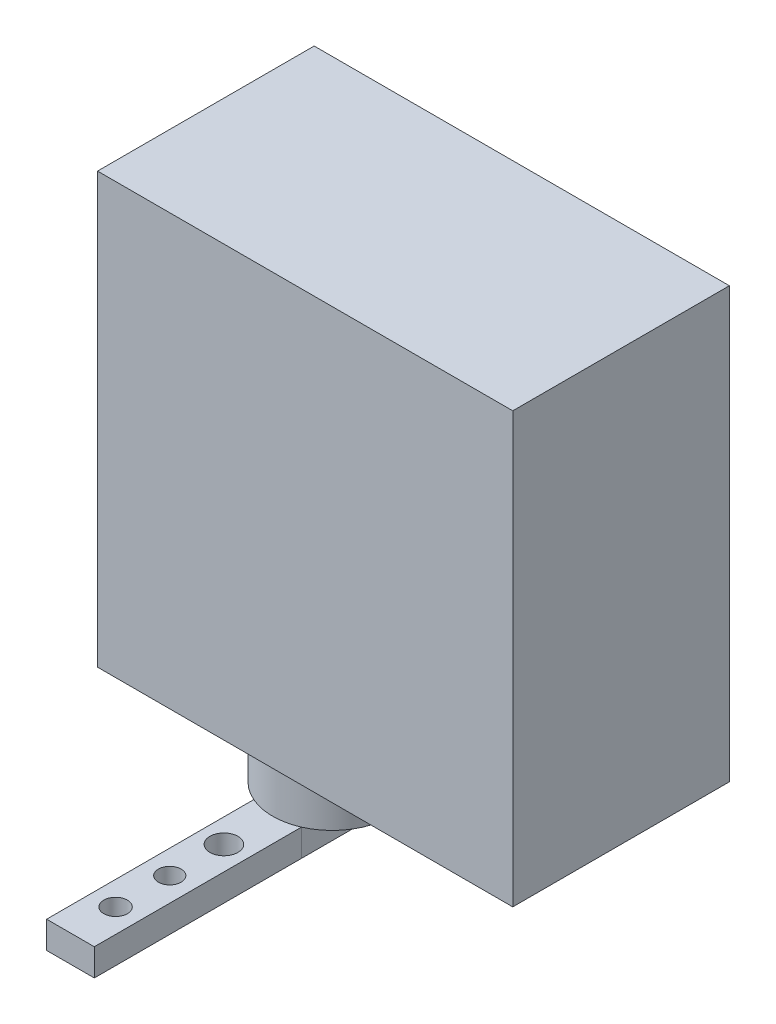
from build123d import *

# Parameters (mm, degrees)
SKETCH1_W           = 23
SKETCH1_H           = 12
BOSS_EXTRUDE1_DEPTH = 23.8
SKETCH2_R           = 3.3
BOSS_EXTRUDE2_DEPTH = 5
SKETCH3_R           = 0.7756072
SKETCH3_R_2         = 0.6312306
SKETCH3_R_3         = 0.654535051
BOSS_EXTRUDE3_DEPTH = 1.5


with BuildPart() as part:
    # Sketch1 → Boss-Extrude1 (new body)
    with BuildSketch(Plane(origin=(0, 0, 0), x_dir=(1, 0, 0), z_dir=(0, 1, 0))):
        with Locations((11.5, 6)):
            Rectangle(SKETCH1_W, SKETCH1_H)
    extrude(amount=BOSS_EXTRUDE1_DEPTH)

    # Sketch2 → Boss-Extrude2 (add)
    with BuildSketch(Plane.XZ):
        with Locations(Location((7, -6, 0), (0, 0, 270))):
            Circle(SKETCH2_R)
    extrude(amount=BOSS_EXTRUDE2_DEPTH)

    # Sketch3 → Boss-Extrude3 (add)
    # profile 1 of 6: a face of its own
    with BuildSketch(Plane.XZ.offset(5)):
        with BuildLine():
            Line((5.679025589, 8.5), (5.679025589, -2.973967359))
            ThreePointArc((5.679025589, -2.973967359), (7, -2.698205497), (8.320974411, -2.973967359))
            Line((8.320974411, -2.973967359), (8.320974411, 8.5))
            Line((8.320974411, 8.5), (5.679025589, 8.5))
        make_face()
        with Locations(Location((7, 0, 0), (0, 0, 270))):
            Circle(SKETCH3_R, mode=Mode.SUBTRACT)
        with Locations(Location((7, 3, 0), (0, 0, 270))):
            Circle(SKETCH3_R_2, mode=Mode.SUBTRACT)
        with Locations(Location((7, 6, 0), (0, 0, 270))):
            Circle(SKETCH3_R_3, mode=Mode.SUBTRACT)
    # profile 2 of 6: a face of its own
    with BuildSketch(Plane.XZ.offset(5)):
        with BuildLine():
            Line((5.679025589, -2.975925496), (5.679025589, -6))
            Line((5.679025589, -6), (8.320974411, -6))
            Line((8.320974411, -6), (8.320974411, -2.975925496))
            ThreePointArc((8.320974411, -2.975925496), (7, -2.7), (5.679025589, -2.975925496))
        make_face()
    # profile 3 of 6: a face of its own
    with BuildSketch(Plane.XZ.offset(5)):
        with BuildLine():
            Line((8.320974411, -6), (5.679025589, -6))
            Line((5.679025589, -6), (5.679025589, -9.024074504))
            ThreePointArc((5.679025589, -9.024074504), (7, -9.3), (8.320974411, -9.024074504))
            Line((8.320974411, -9.024074504), (8.320974411, -6))
        make_face()
    # profile 4 of 6: a face of its own
    with BuildSketch(Plane.XZ.offset(5)):
        with BuildLine():
            Line((5.679025589, -2.975925496), (5.679025589, -6))
            Line((5.679025589, -6), (8.320974411, -6))
            Line((8.320974411, -6), (8.320974411, -2.975925496))
            ThreePointArc((8.320974411, -2.975925496), (7, -2.7), (5.679025589, -2.975925496))
        make_face()
    # profile 5 of 6: a face of its own
    with BuildSketch(Plane.XZ.offset(5)):
        with BuildLine():
            Line((8.320974411, -6), (5.679025589, -6))
            Line((5.679025589, -6), (5.679025589, -9.024074504))
            ThreePointArc((5.679025589, -9.024074504), (7, -9.3), (8.320974411, -9.024074504))
            Line((8.320974411, -9.024074504), (8.320974411, -6))
        make_face()
    # profile 6 of 6: a face of its own
    with BuildSketch(Plane.XZ.offset(5)):
        with BuildLine():
            ThreePointArc((8.320974411, -9.026032641), (7, -9.301794503), (5.679025589, -9.026032641))
            Line((5.679025589, -9.026032641), (5.679025589, -20.5))
            Line((5.679025589, -20.5), (8.320974411, -20.5))
            Line((8.320974411, -20.5), (8.320974411, -9.026032641))
        make_face()
        with Locations(Location((7, -18, 0), (0, 0, 270))):
            Circle(SKETCH3_R_3, mode=Mode.SUBTRACT)
        with Locations(Location((7, -15, 0), (0, 0, 270))):
            Circle(SKETCH3_R_2, mode=Mode.SUBTRACT)
        with Locations(Location((7, -12, 0), (0, 0, 270))):
            Circle(SKETCH3_R, mode=Mode.SUBTRACT)
    extrude(amount=BOSS_EXTRUDE3_DEPTH)


with BuildPart() as boss_extrude3_piece_1:
    # of the separate pieces the step leaves, piece 1, a body of its own (boss_extrude3_pieces)
    add(part.part.solids().sort_by_distance((0, 0, 0))[0])


with BuildPart() as boss_extrude3_piece_2:
    # of the separate pieces the step leaves, piece 2, a body of its own (boss_extrude3_pieces)
    add(part.part.solids().sort_by_distance((5.679025589, -5, -2.973967359))[0])


with BuildPart() as boss_extrude3_piece_3:
    # of the separate pieces the step leaves, piece 3, a body of its own (boss_extrude3_pieces)
    add(part.part.solids().sort_by_distance((8.320974411, -5, -9.026032641))[0])


solid = Compound([boss_extrude3_piece_1.part, boss_extrude3_piece_2.part, boss_extrude3_piece_3.part])
